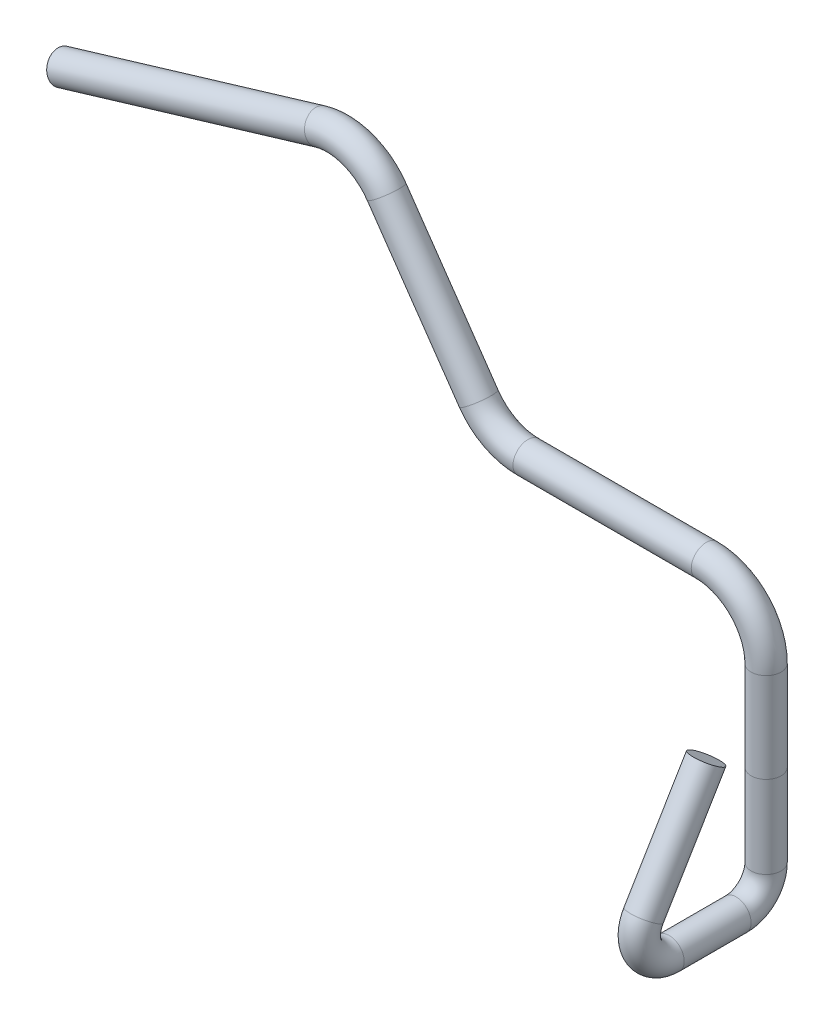
from build123d import *

# Parameters (mm, degrees)
SWEEP1_PROFILE_R = 2.54


with BuildPart() as part:
    # Sweep1: sweep along a curve in space
    with BuildLine() as sweep1_path:
        Line((-119.38, 43.18, 0), (-75.65089034, 56.298732898, 0))
        ThreePointArc((-75.65089034, 56.298732898, 0), (-69.372940802, 56.156071327, 0), (-64.377963156, 52.350391225, 0))
        Line((-64.377963156, 52.350391225, 0), (-48.750110734, 29.776826615, 0))
        ThreePointArc((-48.750110734, 29.776826615, 0), (-45.111961937, 26.560482191, 0), (-40.396638066, 25.4, 0))
        Line((-40.396638066, 25.4, 0), (-10.16, 25.4, 0))
        ThreePointArc((-10.16, 25.4, 0), (-2.975795103, 22.424204897, 0), (0, 15.24, 0))
        Line((0, 15.24, 0), (0, 0, 0))
        Line((0, 0, 0), (0, -13.97, 0))
        ThreePointArc((0, -13.97, 0), (0, -17.562102448, 1.487897552), (0, -19.05, 5.08))
        Line((0, -19.05, 5.08), (0, -19.05, 16.427752875))
        ThreePointArc((0, -19.05, 16.427752875), (0, -16.47290998, 20.848368401), (0, -11.356361562, 20.783816937))
        Line((0, -11.356361562, 20.783816937), (0, 6.35, 10.16))
    # Sweep1 profile (on start of the path) → Sweep1 (sweep)
    with BuildSketch(Plane(origin=(-119.38, 43.18, 0), x_dir=(-0.2873478855663455, 0.9578262852211514, 0), z_dir=(0.9578262852211514, 0.2873478855663455, 0))):
        Circle(SWEEP1_PROFILE_R)
    sweep(path=sweep1_path.line)


solid = part.part
